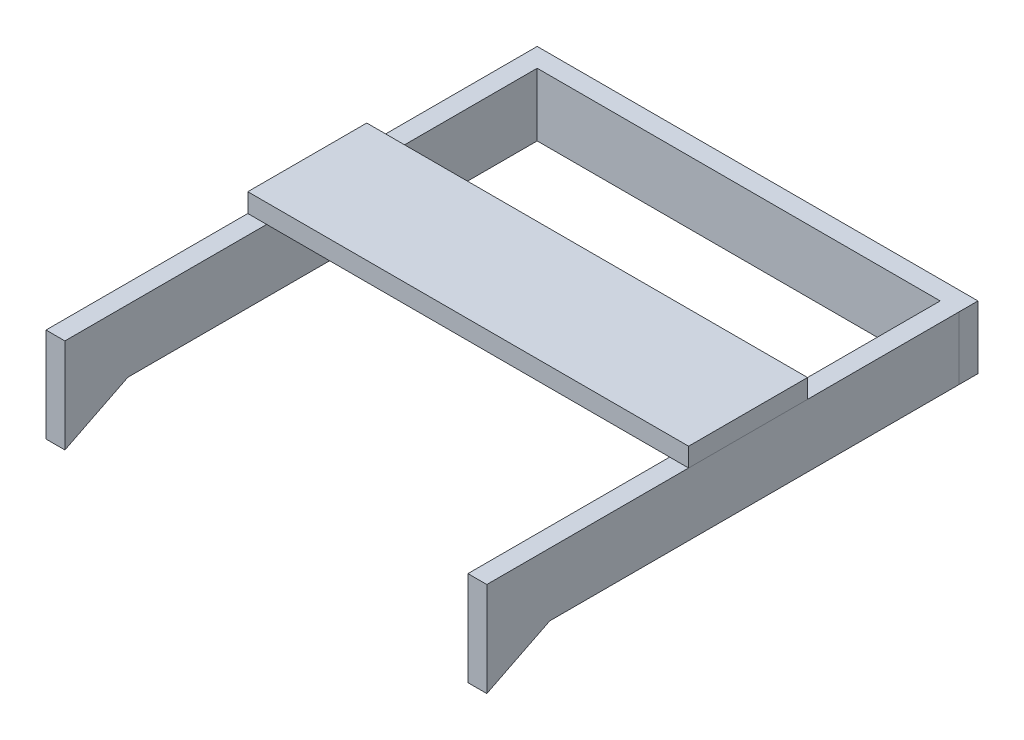
from build123d import *

# Parameters (mm, degrees)
SKETCH1_W           = 70
SKETCH1_H           = 15
BOSS_EXTRUDE1_DEPTH = 3
SKETCH2_W           = 3
SKETCH2_H           = 15
BOSS_EXTRUDE2_DEPTH = 75
CUT_EXTRUDE1_DEPTH  = 75
SKETCH4_W           = 70
SKETCH4_H           = 18.892094127
BOSS_EXTRUDE3_DEPTH = 3


with BuildPart() as part:
    # Sketch1 → Boss-Extrude1 (new body)
    with BuildSketch(Plane.XY):
        with Locations((83.09202796, -33.31343354)):
            Rectangle(SKETCH1_W, SKETCH1_H)
    extrude(amount=BOSS_EXTRUDE1_DEPTH)

    # Sketch2 → Boss-Extrude2 (add)
    with BuildSketch(Plane.XY.offset(3)):
        with Locations((49.59202796, -33.31343354)):
            Rectangle(SKETCH2_W, SKETCH2_H)
        with Locations((116.59202796, -33.31343354)):
            Rectangle(SKETCH2_W, SKETCH2_H)
    extrude(amount=BOSS_EXTRUDE2_DEPTH)

    # Sketch3 → Cut-Extrude1 (cut)
    with BuildSketch(Plane.ZY.offset(-48.09202796)):
        Polygon((0, -40.81343354), (78, -40.81343354), (68, -35.81343354), (0, -35.81343354), align=None)
    extrude(amount=-CUT_EXTRUDE1_DEPTH, mode=Mode.SUBTRACT)

    # Sketch4 → Boss-Extrude3 (add)
    with BuildSketch(Plane(origin=(0, -25.81343354, 0), x_dir=(1, 0, 0), z_dir=(0, 1, 0))):
        with Locations((83.09202796, -36.511528279)):
            Rectangle(SKETCH4_W, SKETCH4_H)
    extrude(amount=BOSS_EXTRUDE3_DEPTH)


solid = part.part
